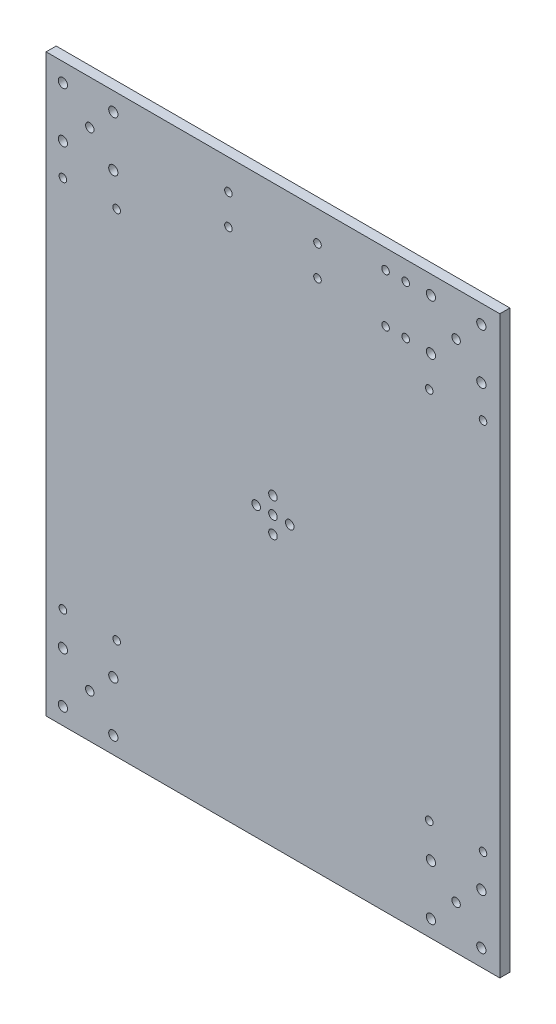
from build123d import *

# Parameters (mm, degrees)
SKETCH_3_W                  = 270
SKETCH_3_H                  = 342.3
SKETCH_3_R                  = 2.55
SKETCH_3_R_2                = 2.25
EXTRUDE_1_DEPTH             = 6
SKETCH_4_R                  = 2.5
CUT_EXTRUDE_1_DEPTH         = 219.06724307
PATTERN_LINEAR_1_COUNT      = 2
PATTERN_LINEAR_1_PITCH      = 218
PATTERN_LINEAR_1_COUNT_DIR2 = 2
PATTERN_LINEAR_1_PITCH_DIR2 = 290.3
SKETCH_7_R                  = 2.25
CUT_EXTRUDE_2_DEPTH         = 219.06724307
SKETCH_8_R                  = 2.25
CUT_EXTRUDE_3_DEPTH         = 219.06724307
PATTERN_LINEAR_2_COUNT      = 2
PATTERN_LINEAR_2_PITCH      = 222.3
PATTERN_LINEAR_2_COUNT_DIR2 = 2
PATTERN_LINEAR_2_PITCH_DIR2 = 218
SKETCH_10_R                 = 2.75
CUT_EXTRUDE_4_DEPTH         = 219.06724307
PATTERN_LINEAR_3_COUNT      = 2
PATTERN_LINEAR_3_PITCH      = 219
PATTERN_LINEAR_3_COUNT_DIR2 = 2
PATTERN_LINEAR_3_PITCH_DIR2 = 291.3


with BuildPart() as part:
    # Эскиз3 → Бобышка-Вытянуть1 (new body)
    with BuildSketch(Plane.XY):
        Rectangle(SKETCH_3_W, SKETCH_3_H)
        Circle(SKETCH_3_R, mode=Mode.SUBTRACT)
        with Locations((0, 10)):
            Circle(SKETCH_3_R, mode=Mode.SUBTRACT)
        with Locations((10, 0)):
            Circle(SKETCH_3_R, mode=Mode.SUBTRACT)
        with Locations((0, -10)):
            Circle(SKETCH_3_R, mode=Mode.SUBTRACT)
        with Locations((-10, 0)):
            Circle(SKETCH_3_R, mode=Mode.SUBTRACT)
        with Locations((67, 159.65)):
            Circle(SKETCH_3_R_2, mode=Mode.SUBTRACT)
        with Locations((79, 159.65)):
            Circle(SKETCH_3_R_2, mode=Mode.SUBTRACT)
        with Locations((67, 130.65)):
            Circle(SKETCH_3_R_2, mode=Mode.SUBTRACT)
        with Locations((79, 130.65)):
            Circle(SKETCH_3_R_2, mode=Mode.SUBTRACT)
    extrude(amount=EXTRUDE_1_DEPTH)

    # Эскиз4 → Вырез-Вытянуть1 (cut, through all)
    with BuildSketch(Plane.XY.offset(6)):
        with Locations((-109, 145.15)):
            Circle(SKETCH_4_R)
    cut_extrude_1 = extrude(amount=-CUT_EXTRUDE_1_DEPTH, mode=Mode.SUBTRACT)

    # Линейный массив1: Cut-Extrude 1 2 × 2
    with Locations(*[(i * PATTERN_LINEAR_1_PITCH, -j * PATTERN_LINEAR_1_PITCH_DIR2, 0) for i in range(PATTERN_LINEAR_1_COUNT) for j in range(PATTERN_LINEAR_1_COUNT_DIR2) if (i, j) != (0, 0)]):
        add(cut_extrude_1, mode=Mode.SUBTRACT)

    # Эскиз7 → Вырез-Вытянуть2 (cut, through all)
    with BuildSketch(Plane(origin=(0, 0, 0), x_dir=(-1, 0, 0), z_dir=(0, 0, -1))):
        with Locations((-26.5, 153.15)):
            Circle(SKETCH_7_R)
        with Locations((26.5, 153.15)):
            Circle(SKETCH_7_R)
        with Locations((-26.5, 135.15)):
            Circle(SKETCH_7_R)
        with Locations((26.5, 135.15)):
            Circle(SKETCH_7_R)
    extrude(amount=-CUT_EXTRUDE_2_DEPTH, mode=Mode.SUBTRACT)

    # Эскиз8 → Вырез-Вытянуть3 (cut, through all)
    with BuildSketch(Plane(origin=(0, 0, 0), x_dir=(-1, 0, 0), z_dir=(0, 0, -1))):
        with Locations((93, 111.15)):
            Circle(SKETCH_8_R)
        with Locations((125, 111.15)):
            Circle(SKETCH_8_R)
    cut_extrude_3 = extrude(amount=-CUT_EXTRUDE_3_DEPTH, mode=Mode.SUBTRACT)

    # Линейный массив2: Cut-Extrude 3 2 × 2
    with Locations(*[(j * PATTERN_LINEAR_2_PITCH_DIR2, -i * PATTERN_LINEAR_2_PITCH, 0) for i in range(PATTERN_LINEAR_2_COUNT) for j in range(PATTERN_LINEAR_2_COUNT_DIR2) if (i, j) != (0, 0)]):
        add(cut_extrude_3, mode=Mode.SUBTRACT)

    # Эскиз10 → Вырез-Вытянуть4 (cut, through all)
    with BuildSketch(Plane(origin=(0, 0, 0), x_dir=(-1, 0, 0), z_dir=(0, 0, -1))):
        with Locations((-124, 160.15)):
            Circle(SKETCH_10_R)
        with Locations((-94, 160.15)):
            Circle(SKETCH_10_R)
        with Locations((-94, 130.15)):
            Circle(SKETCH_10_R)
        with Locations((-124, 130.15)):
            Circle(SKETCH_10_R)
    cut_extrude_4 = extrude(amount=-CUT_EXTRUDE_4_DEPTH, mode=Mode.SUBTRACT)

    # Линейный массив3: Cut-Extrude 4 2 × 2
    with Locations(*[(-i * PATTERN_LINEAR_3_PITCH, -j * PATTERN_LINEAR_3_PITCH_DIR2, 0) for i in range(PATTERN_LINEAR_3_COUNT) for j in range(PATTERN_LINEAR_3_COUNT_DIR2) if (i, j) != (0, 0)]):
        add(cut_extrude_4, mode=Mode.SUBTRACT)


solid = part.part
